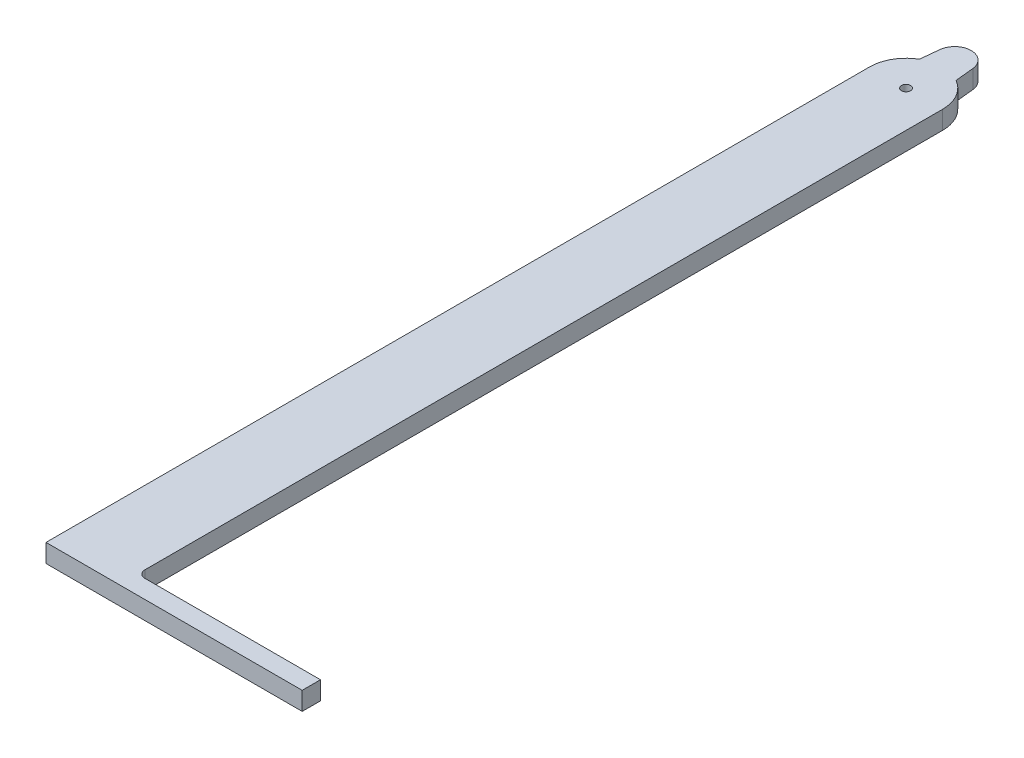
from build123d import *

# Parameters (mm, degrees)
BOSS_EXTRUDE1_DEPTH = 6.35
SKETCH2_W           = 88.9
SKETCH2_H           = 6.35
BOSS_EXTRUDE2_DEPTH = 6.35
FILLET1_R           = 2.54
BOSS_EXTRUDE3_DEPTH = 6.35
SKETCH4_R           = 1.5875
CUT_EXTRUDE1_DEPTH  = 296.803693351


with BuildPart() as part:
    # Sketch1 → Boss-Extrude1 (new body)
    with BuildSketch(Plane(origin=(0, 0, 0), x_dir=(1, 0, 0), z_dir=(0, 1, 0))):
        with BuildLine():
            ThreePointArc((12.7, 0), (0, -12.7), (-12.7, 0))
            Line((-12.7, 0), (-12.7, -279.4))
            Line((-12.7, -279.4), (12.7, -279.4))
            Line((12.7, -279.4), (12.7, 0))
        make_face()
        with BuildLine():
            ThreePointArc((12.7, 0), (0, 12.7), (-12.7, 0))
            Line((-12.7, 0), (12.7, 0))
        make_face()
        with BuildLine():
            Line((12.7, 0), (-12.7, 0))
            ThreePointArc((-12.7, 0), (0, -12.7), (12.7, 0))
        make_face()
    extrude(amount=BOSS_EXTRUDE1_DEPTH)

    # Sketch2 → Boss-Extrude2 (add)
    with BuildSketch(Plane(origin=(0, 6.35, 0), x_dir=(1, 0, 0), z_dir=(0, 1, 0))):
        with Locations((31.75, -282.575)):
            Rectangle(SKETCH2_W, SKETCH2_H)
    extrude(amount=-BOSS_EXTRUDE2_DEPTH)

    # Fillet1
    fillet1_edges = [part.edges().sort_by_distance(p)[0] for p in [
        (12.7, 3.175, 279.4),
    ]]
    fillet(fillet1_edges, radius=FILLET1_R)

    # Sketch3 → Boss-Extrude3 (add)
    with BuildSketch(Plane(origin=(0, 0, 0), x_dir=(-1, 0, 0), z_dir=(0, -1, 0))):
        with BuildLine():
            Line((-7.384124229, 1.213847931), (7.384124229, 1.213847931))
            Line((7.384124229, 1.213847931), (5.698055631, 17.468424552))
            ThreePointArc((5.698055631, 17.468424552), (0, 22.606), (-5.698055631, 17.468424552))
            Line((-5.698055631, 17.468424552), (-7.384124229, 1.213847931))
        make_face()
    extrude(amount=-BOSS_EXTRUDE3_DEPTH)

    # Sketch4 → Cut-Extrude1 (cut, through all)
    with BuildSketch(Plane(origin=(0, 0, 0), x_dir=(-1, 0, 0), z_dir=(0, -1, 0))):
        with Locations(Location((0, 0, 0), (0, 0, 90))):
            Circle(SKETCH4_R)
    extrude(amount=-CUT_EXTRUDE1_DEPTH, mode=Mode.SUBTRACT)


solid = part.part
